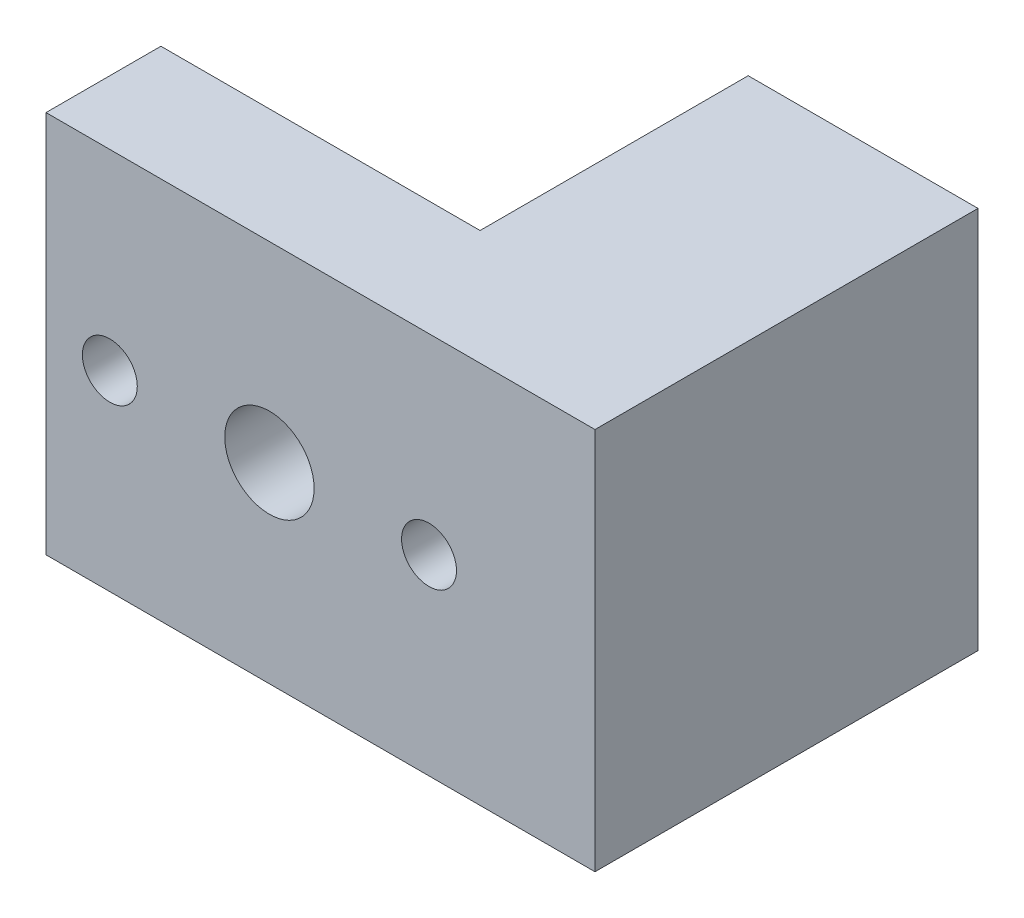
from build123d import *

# Parameters (mm, degrees)
SKETCH1_W           = 43
SKETCH1_H           = 30
SKETCH1_R           = 2.15
SKETCH1_R_2         = 3.5
BOSS_EXTRUDE1_DEPTH = 9
SKETCH2_W           = 18
SKETCH2_H           = 30
BOSS_EXTRUDE2_DEPTH = 21
SKETCH3_R           = 2.15
CUT_EXTRUDE1_DEPTH  = 340.846521731


with BuildPart() as part:
    # Sketch1 → Boss-Extrude1 (new body)
    with BuildSketch(Plane.XY):
        with Locations((-311.200177837, -47.5)):
            Rectangle(SKETCH1_W, SKETCH1_H)
        with Locations((-327.700177837, -47.5)):
            Circle(SKETCH1_R, mode=Mode.SUBTRACT)
        with Locations((-315.200177837, -47.5)):
            Circle(SKETCH1_R_2, mode=Mode.SUBTRACT)
    extrude(amount=BOSS_EXTRUDE1_DEPTH)

    # Sketch2 → Boss-Extrude2 (add)
    with BuildSketch(Plane(origin=(0, 0, 0), x_dir=(-1, 0, 0), z_dir=(0, 0, -1))):
        with Locations((298.700177837, -47.5)):
            Rectangle(SKETCH2_W, SKETCH2_H)
    extrude(amount=BOSS_EXTRUDE2_DEPTH)

    # Sketch3 → Cut-Extrude1 (cut, through all)
    with BuildSketch(Plane.XY.offset(9)):
        with Locations((-302.700177837, -47.5)):
            Circle(SKETCH3_R)
    extrude(amount=-CUT_EXTRUDE1_DEPTH, mode=Mode.SUBTRACT)


solid = part.part
